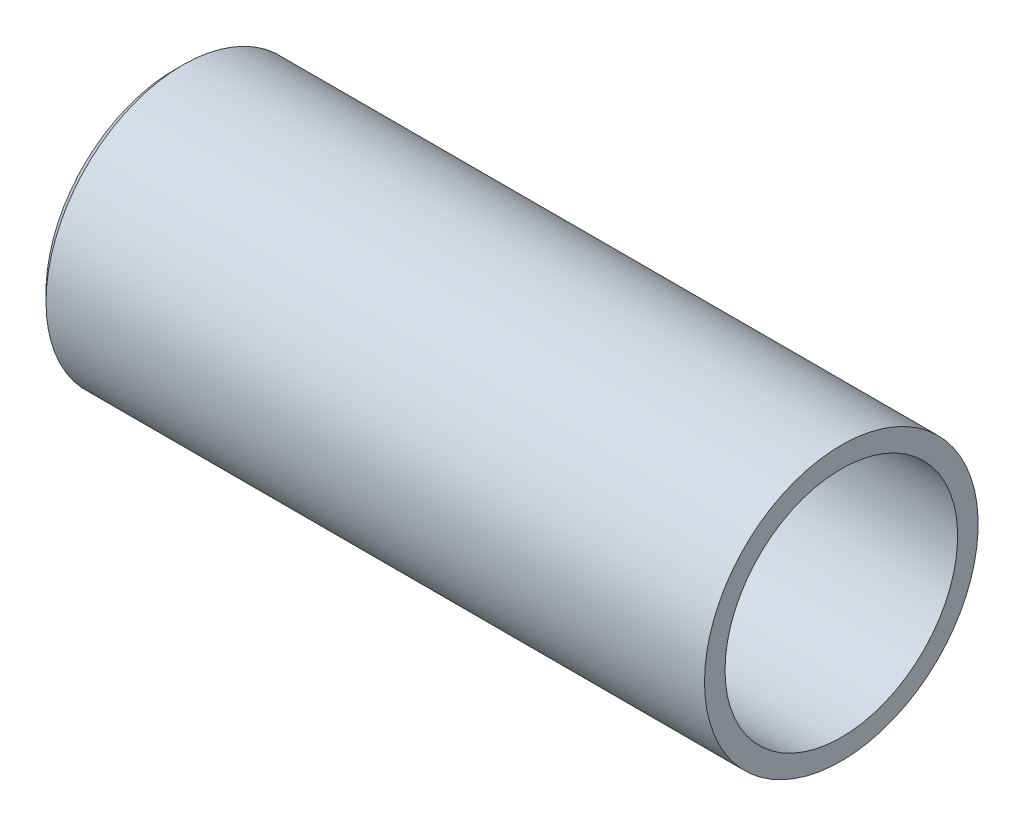
from build123d import *

# Parameters (mm, degrees)
SKETCH_2_W     = 39
SKETCH_2_H     = 8
SHELL_4_T      = -1.2
CHAMFER_2_SIZE = 0.5


with BuildPart() as part:
    # 草图2 → 旋转2 (revolve)
    with BuildSketch(Plane(origin=(0, 17.555203641, 0), x_dir=(1, 0, 0), z_dir=(0, 0, 1)), mode=Mode.PRIVATE) as revolve_2_sk:
        with Locations((21.172378693, 10.620939958)):
            Rectangle(SKETCH_2_W, SKETCH_2_H)
    revolve(revolve_2_sk.sketch.rotate(Axis((1.672378693, 24.176143599, 0), (1, 0, 0)), 90), axis=Axis((1.672378693, 24.176143599, 0), (1, 0, 0)))

    # 抽壳4
    shell_4_openings = [part.faces().sort_by_distance(p)[0] for p in [
        (40.672378693, 24.176143599, 0),
    ]]
    offset(amount=SHELL_4_T, openings=shell_4_openings, kind=Kind.INTERSECTION)

    # 倒角2
    chamfer_2_edges = [part.edges().sort_by_distance(p)[0] for p in [
        (2.872378693, 24.176143599, -6.8),
        (1.672378693, 24.176143599, -8),
    ]]
    chamfer(chamfer_2_edges, length=CHAMFER_2_SIZE)


solid = part.part
